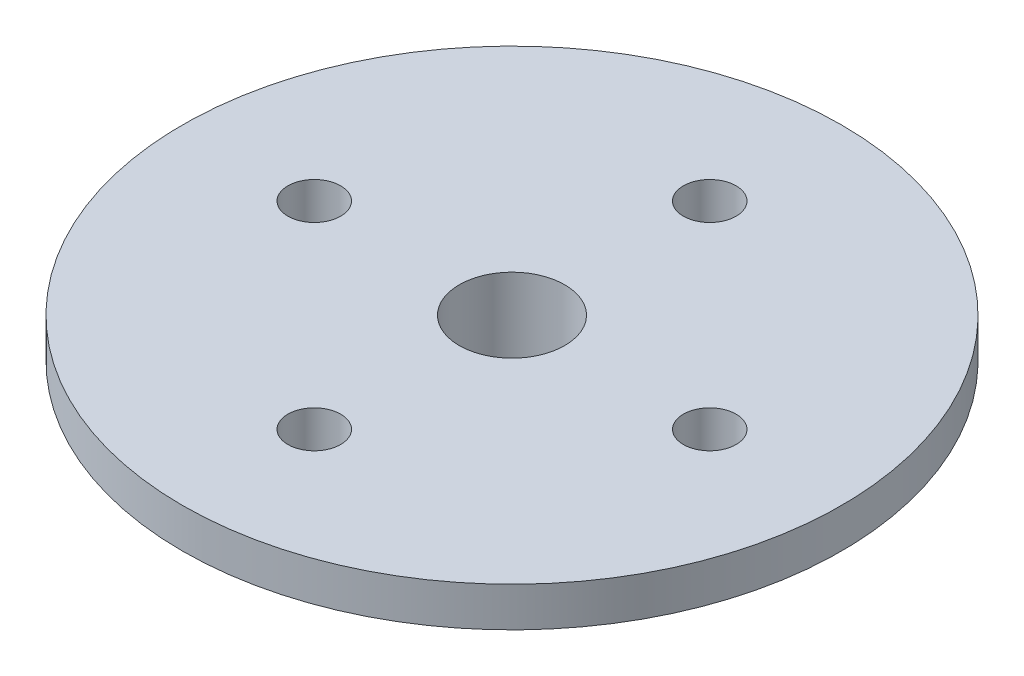
from build123d import *

# Parameters (mm, degrees)
SKETCH_2_R          = 2
SKETCH_2_R_2        = 4
CUT_EXTRUDE_1_DEPTH = 36.860842154


with BuildPart() as part:
    # 草图1 → 旋转1 (revolve)
    with BuildSketch(Plane.XY, mode=Mode.PRIVATE) as revolve_1_sk:
        Polygon((0, 3), (-25, 3), (-25, 0), (-18.5, 0), (-18.5, -3), (0, -3), align=None)
    revolve(revolve_1_sk.sketch.rotate(Axis((0, 11.295290754, 0), (0, -1, 0)), 270), axis=Axis((0, 11.295290754, 0), (0, -1, 0)))

    # 草图2 → 切除-拉伸1 (cut, through all)
    with BuildSketch(Plane(origin=(0, 3, 0), x_dir=(1, 0, 0), z_dir=(0, 1, 0))):
        with Locations(Location((0, 15, 0), (0, 0, 270))):
            Circle(SKETCH_2_R)
        with Locations(Location((15, 0, 0), (0, 0, 270))):
            Circle(SKETCH_2_R)
        with Locations(Location((0, -15, 0), (0, 0, 270))):
            Circle(SKETCH_2_R)
        with Locations(Location((-15, 0, 0), (0, 0, 270))):
            Circle(SKETCH_2_R)
        with Locations(Location((0, 0, 0), (0, 0, 270))):
            Circle(SKETCH_2_R_2)
    extrude(amount=-CUT_EXTRUDE_1_DEPTH, mode=Mode.SUBTRACT)


solid = part.part
